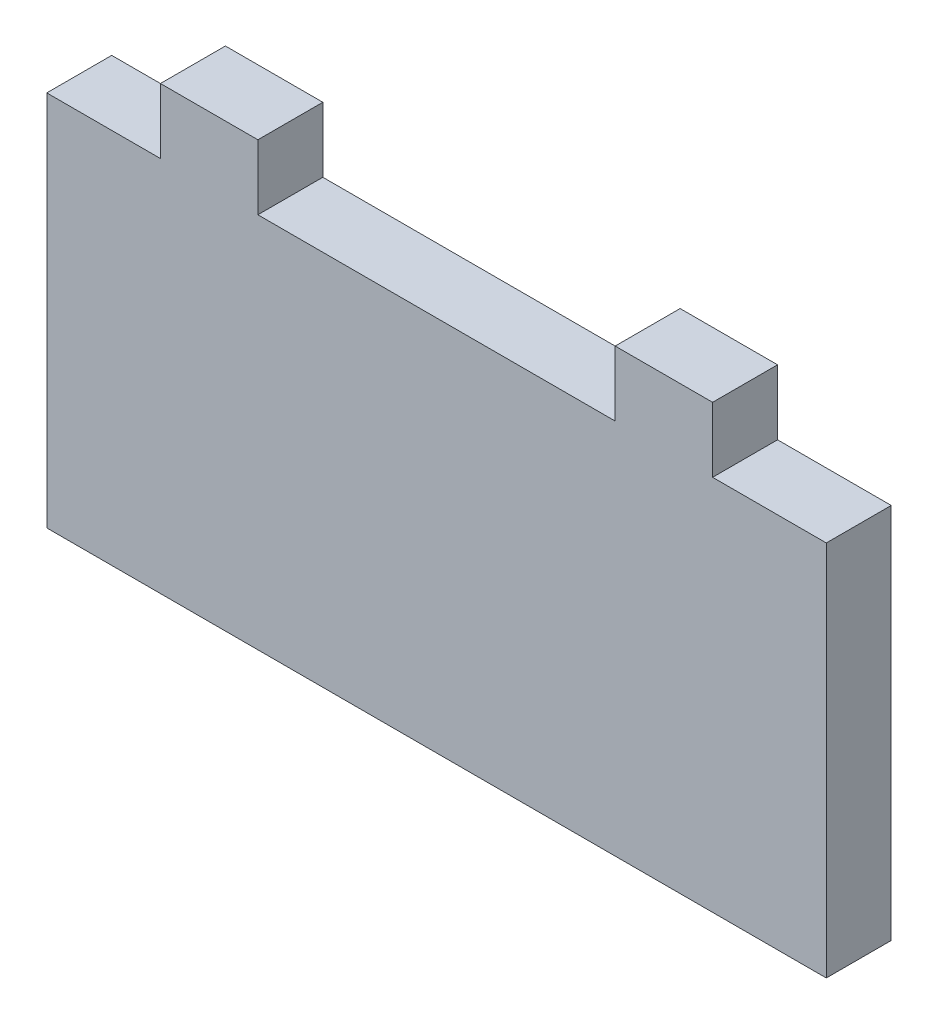
from build123d import *

# Parameters (mm, degrees)
EXTRUDE1_DEPTH = 12.7


with BuildPart() as part:
    # Sketch1 → Extrude1 (new body)
    with BuildSketch(Plane.XY):
        Polygon((-76.2, 215.9), (-53.975, 215.9), (-53.975, 228.6), (-34.925, 228.6), (-34.925, 215.9), (34.925, 215.9), (34.925, 228.6), (53.975, 228.6), (53.975, 215.9), (76.2, 215.9), (76.2, 142.24), (-76.2, 142.24), align=None)
    extrude(amount=-EXTRUDE1_DEPTH)


solid = part.part
